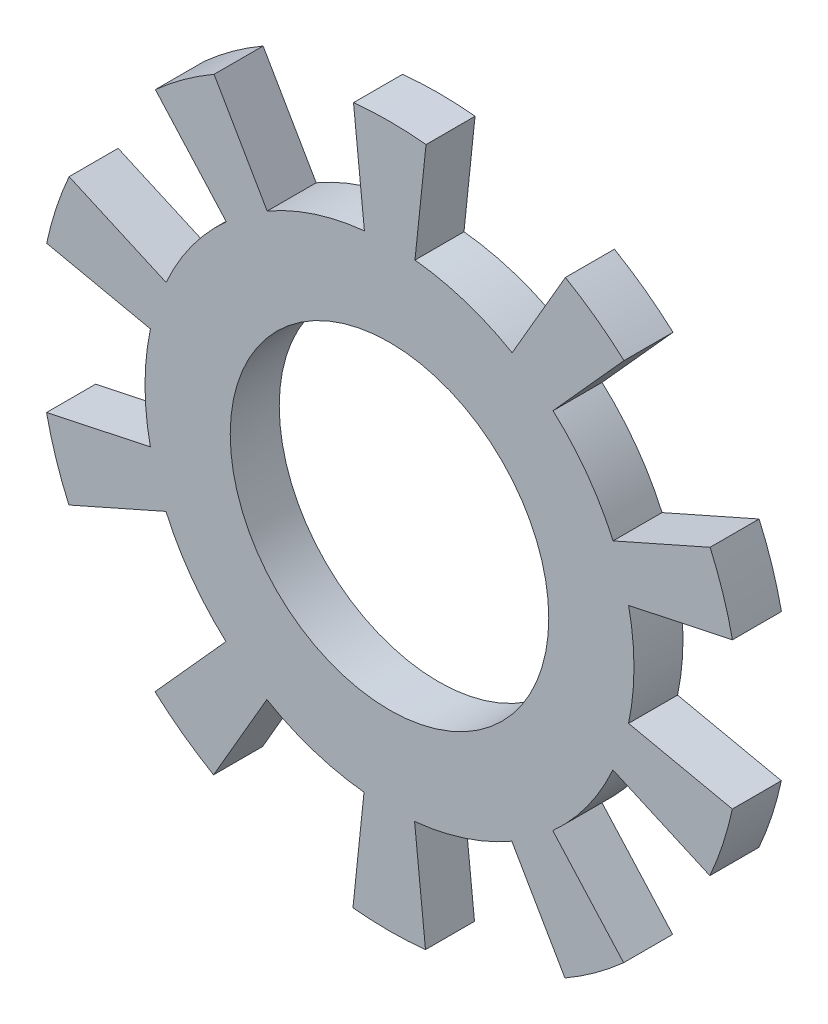
from build123d import *

# Parameters (mm, degrees)
SKETCH1_R           = 4.1275
BOSS_EXTRUDE1_DEPTH = 1.27


with BuildPart() as part:
    # Sketch1 → Boss-Extrude1 (new body)
    with BuildSketch(Plane.XY):
        with BuildLine():
            Line((-0.66010495, -6.301124731), (-0.946700317, -9.036861149))
            ThreePointArc((-0.946700317, -9.036861149), (-0.007173127, -9.086311103), (0.932430967, -9.038344617))
            Line((0.932430967, -9.038344617), (0.650155372, -6.302159107))
            ThreePointArc((0.650155372, -6.302159107), (1.953052705, -6.027063676), (3.169672067, -5.485716945))
            Line((3.169672067, -5.485716945), (4.545837066, -7.86743073))
            ThreePointArc((4.545837066, -7.86743073), (5.334996482, -7.355196357), (6.066958169, -6.764105225))
            Line((6.066958169, -6.764105225), (4.230302926, -4.716402079))
            ThreePointArc((4.230302926, -4.716402079), (5.122671972, -3.728021363), (5.788742087, -2.57495174))
            Line((5.788742087, -2.57495174), (8.302019196, -3.692909176))
            ThreePointArc((8.302019196, -3.692909176), (8.639378766, -2.814646597), (8.884113559, -1.906207541))
            Line((8.884113559, -1.906207541), (6.194618544, -1.329139762))
            ThreePointArc((6.194618544, -1.329139762), (6.335604659, -0.005001601), (6.196709383, 1.319357511))
            Line((6.196709383, 1.319357511), (8.887112169, 1.892178166))
            ThreePointArc((8.887112169, 1.892178166), (8.643812002, 2.801002498), (8.30783953, 3.679796635))
            Line((8.30783953, 3.679796635), (5.792800426, 2.565808769))
            ThreePointArc((5.792800426, 2.565808769), (5.128551706, 3.719928603), (4.237744312, 4.709717036))
            Line((4.237744312, 4.709717036), (6.077630355, 6.754517761))
            ThreePointArc((6.077630355, 6.754517761), (5.346602846, 7.34676384), (4.558253173, 7.860243567))
            Line((4.558253173, 7.860243567), (3.178329436, 5.480705558))
            ThreePointArc((3.178329436, 5.480705558), (1.962566314, 6.023972516), (0.66010495, 6.301124731))
            Line((0.66010495, 6.301124731), (0.946700317, 9.036861149))
            ThreePointArc((0.946700317, 9.036861149), (0.007173127, 9.086311103), (-0.932430967, 9.038344617))
            Line((-0.932430967, 9.038344617), (-0.650155372, 6.302159107))
            ThreePointArc((-0.650155372, 6.302159107), (-1.953052705, 6.027063676), (-3.169672067, 5.485716945))
            Line((-3.169672067, 5.485716945), (-4.545837066, 7.86743073))
            ThreePointArc((-4.545837066, 7.86743073), (-5.334996482, 7.355196357), (-6.066958169, 6.764105225))
            Line((-6.066958169, 6.764105225), (-4.230302926, 4.716402079))
            ThreePointArc((-4.230302926, 4.716402079), (-5.122671972, 3.728021363), (-5.788742087, 2.57495174))
            Line((-5.788742087, 2.57495174), (-8.302019196, 3.692909176))
            ThreePointArc((-8.302019196, 3.692909176), (-8.639378766, 2.814646597), (-8.884113559, 1.906207541))
            Line((-8.884113559, 1.906207541), (-6.194618544, 1.329139762))
            ThreePointArc((-6.194618544, 1.329139762), (-6.335604659, 0.005001601), (-6.196709383, -1.319357511))
            Line((-6.196709383, -1.319357511), (-8.887112169, -1.892178166))
            ThreePointArc((-8.887112169, -1.892178166), (-8.643812002, -2.801002498), (-8.30783953, -3.679796635))
            Line((-8.30783953, -3.679796635), (-5.792800426, -2.565808769))
            ThreePointArc((-5.792800426, -2.565808769), (-5.128551706, -3.719928603), (-4.237744312, -4.709717036))
            Line((-4.237744312, -4.709717036), (-6.077630355, -6.754517761))
            ThreePointArc((-6.077630355, -6.754517761), (-5.346602846, -7.34676384), (-4.558253173, -7.860243567))
            Line((-4.558253173, -7.860243567), (-3.178329436, -5.480705558))
            ThreePointArc((-3.178329436, -5.480705558), (-1.962566314, -6.023972516), (-0.66010495, -6.301124731))
        make_face()
        Circle(SKETCH1_R, mode=Mode.SUBTRACT)
    extrude(amount=BOSS_EXTRUDE1_DEPTH)


solid = part.part
